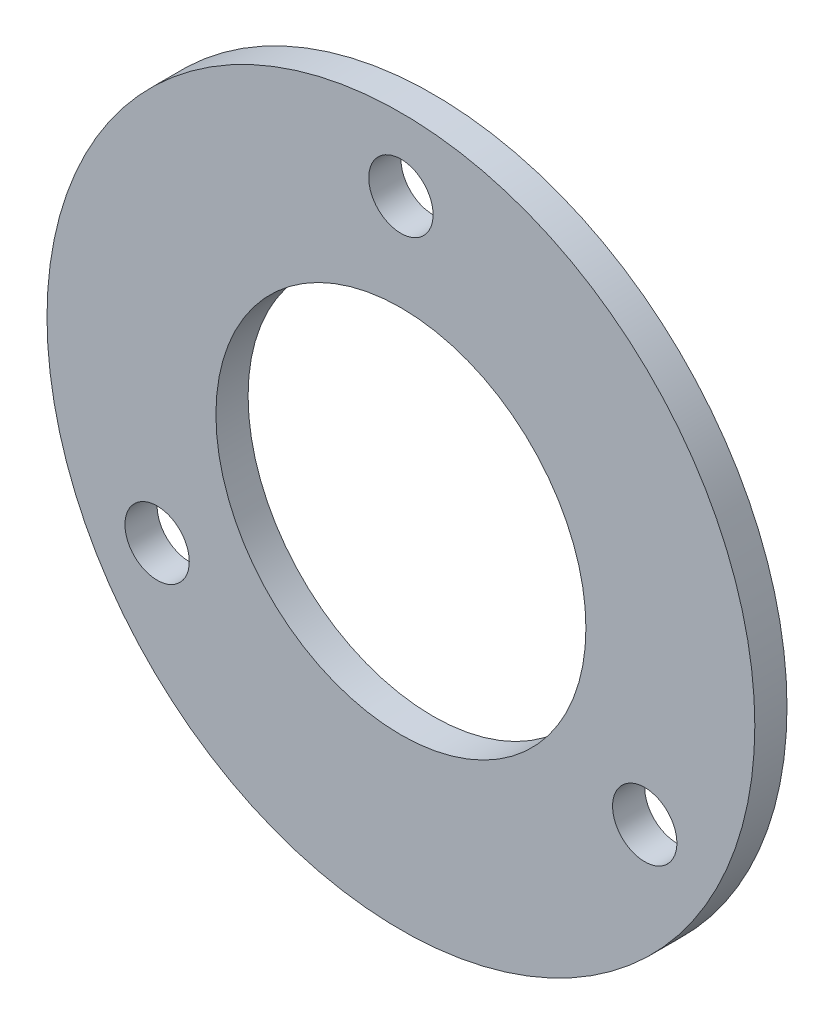
from build123d import *

# Parameters (mm, degrees)
SKETCH_1_R      = 22
SKETCH_1_R_2    = 2
SKETCH_1_R_3    = 11.5
EXTRUDE_1_DEPTH = 2


with BuildPart() as part:
    # 草图1 → 凸台-拉伸1 (new body)
    with BuildSketch(Plane.XY):
        Circle(SKETCH_1_R)
        with Locations((0, 17.5)):
            Circle(SKETCH_1_R_2, mode=Mode.SUBTRACT)
        with Locations((15.155444566, -8.75)):
            Circle(SKETCH_1_R_2, mode=Mode.SUBTRACT)
        with Locations((-15.155444566, -8.75)):
            Circle(SKETCH_1_R_2, mode=Mode.SUBTRACT)
        Circle(SKETCH_1_R_3, mode=Mode.SUBTRACT)
    extrude(amount=EXTRUDE_1_DEPTH)


solid = part.part
